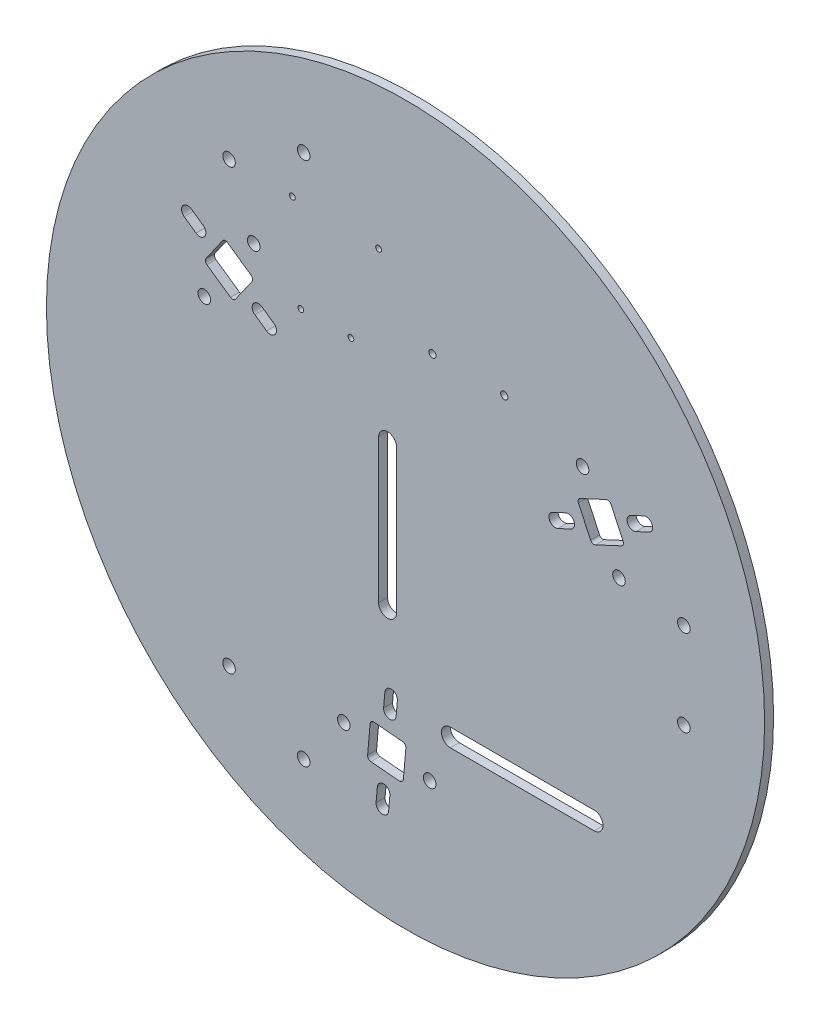
from build123d import *

# Parameters (mm, degrees)
SKETCH1_R           = 200
BOSS_EXTRUDE2_DEPTH = 5
SKETCH9_R           = 3.5
CUT_EXTRUDE8_DEPTH  = 5
CIRPATTERN5_COUNT   = 3
SKETCH15_R          = 2
CUT_EXTRUDE13_DEPTH = 5
SKETCH17_R          = 3.5
CUT_EXTRUDE15_DEPTH = 5
CIRPATTERN7_COUNT   = 3
CUT_EXTRUDE16_DEPTH = 5
CUT_EXTRUDE17_DEPTH = 5
SKETCH20_R          = 1.6
CUT_EXTRUDE18_DEPTH = 5
FILLET1_R           = 2


with BuildPart() as part:
    # Sketch1 → Boss-Extrude2 (new body)
    with BuildSketch(Plane.XY):
        Circle(SKETCH1_R)
    extrude(amount=BOSS_EXTRUDE2_DEPTH)

    # Sketch9 → Cut-Extrude8 (cut)
    with BuildSketch(Plane.XY.offset(5)):
        with Locations((-56.715390309, 146.233937587)):
            Circle(SKETCH9_R)
        with Locations((-98.284609691, 122.233937587)):
            Circle(SKETCH9_R)
    cut_extrude8 = extrude(amount=-CUT_EXTRUDE8_DEPTH, mode=Mode.SUBTRACT)

    # CirPattern5: Cut-Extrude8 ×3 about axis
    cirpattern5_axis = Axis((0, 0, 0), (0, 0, 1))
    for i in range(1, CIRPATTERN5_COUNT):
        add(cut_extrude8.rotate(cirpattern5_axis, i * 360 / CIRPATTERN5_COUNT), mode=Mode.SUBTRACT)

    # Sketch15 → Cut-Extrude13 (cut)
    with BuildSketch(Plane.XY.offset(5)):
        with Locations((15, 85)):
            Circle(SKETCH15_R)
        with Locations((55, 85)):
            Circle(SKETCH15_R)
    extrude(amount=-CUT_EXTRUDE13_DEPTH, mode=Mode.SUBTRACT)

    # Sketch17 → Cut-Extrude15 (cut)
    with BuildSketch(Plane.XY.offset(5)):
        with Locations((-84.532410842, 88.488821425)):
            Circle(SKETCH17_R)
        with Locations((-112.064079787, 49.169523299)):
            Circle(SKETCH17_R)
        Polygon((-112.225530121, 66.373416283), (-95.842489235, 54.901887556), (-84.370960508, 71.284928442), (-100.754001394, 82.756457169), align=None)
        with BuildLine():
            Line((-79.907686902, 60.22467579), (-73.354470547, 55.636064299))
            ThreePointArc((-73.354470547, 55.636064299), (-72.49495592, 50.761514617), (-77.369505602, 49.901999989))
            Line((-77.369505602, 49.901999989), (-83.922721956, 54.49061148))
            ThreePointArc((-83.922721956, 54.49061148), (-84.782236584, 59.365161162), (-79.907686902, 60.22467579))
        make_face()
        with BuildLine():
            Line((-112.673768673, 83.167733244), (-119.226985028, 87.756344735))
            ThreePointArc((-119.226985028, 87.756344735), (-124.10153471, 86.896830107), (-123.242020082, 82.022280425))
            Line((-123.242020082, 82.022280425), (-116.688803728, 77.433668934))
            ThreePointArc((-116.688803728, 77.433668934), (-111.814254045, 78.293183562), (-112.673768673, 83.167733244))
        make_face()
    cut_extrude15 = extrude(amount=-CUT_EXTRUDE15_DEPTH, mode=Mode.SUBTRACT)

    # CirPattern7: Cut-Extrude15 ×3 about axis
    cirpattern7_axis = Axis((0, 0, 0), (0, 0, 1))
    for i in range(1, CIRPATTERN7_COUNT):
        add(cut_extrude15.rotate(cirpattern7_axis, i * 360 / CIRPATTERN7_COUNT), mode=Mode.SUBTRACT)

    # Sketch18 → Cut-Extrude16 (cut)
    with BuildSketch(Plane.XY.offset(5)):
        with BuildLine():
            Line((-5, 30), (-5, -50))
            ThreePointArc((-5, -50), (-10, -55), (-15, -50))
            Line((-15, -50), (-15, 30))
            ThreePointArc((-15, 30), (-10, 35), (-5, 30))
        make_face()
    extrude(amount=-CUT_EXTRUDE16_DEPTH, mode=Mode.SUBTRACT)

    # Sketch19 → Cut-Extrude17 (cut)
    with BuildSketch(Plane.XY.offset(5)):
        with BuildLine():
            Line((25, -90), (105, -90))
            ThreePointArc((105, -90), (110, -95), (105, -100))
            Line((105, -100), (25, -100))
            ThreePointArc((25, -100), (20, -95), (25, -90))
        make_face()
    extrude(amount=-CUT_EXTRUDE17_DEPTH, mode=Mode.SUBTRACT)

    # Sketch20 → Cut-Extrude18 (cut)
    with BuildSketch(Plane.XY.offset(5)):
        with Locations((-63, 121.9)):
            Circle(SKETCH20_R)
        with Locations((-15, 120.8)):
            Circle(SKETCH20_R)
        with Locations((-58.3, 70)):
            Circle(SKETCH20_R)
        with Locations((-30.4, 70)):
            Circle(SKETCH20_R)
    extrude(amount=-CUT_EXTRUDE18_DEPTH, mode=Mode.SUBTRACT)

    # Fillet1
    fillet1_edges = [part.edges().sort_by_distance(p)[0] for p in [
        (-1.368299576, -130.376868179, 2.5),
        (-21.292193538, -128.633753324, 2.5),
        (-19.549078683, -108.709859363, 2.5),
        (0.374815279, -110.452974218, 2.5),
        (113.593829697, 64.003451897, 2.5),
        (122.046194932, 45.877296156, 2.5),
        (103.920039191, 37.424930921, 2.5),
        (95.467673957, 55.551086662, 2.5),
        (-112.225530121, 66.373416283, 2.5),
        (-100.754001394, 82.756457169, 2.5),
        (-84.370960508, 71.284928442, 2.5),
        (-95.842489235, 54.901887556, 2.5),
    ]]
    fillet(fillet1_edges, radius=FILLET1_R)


solid = part.part
